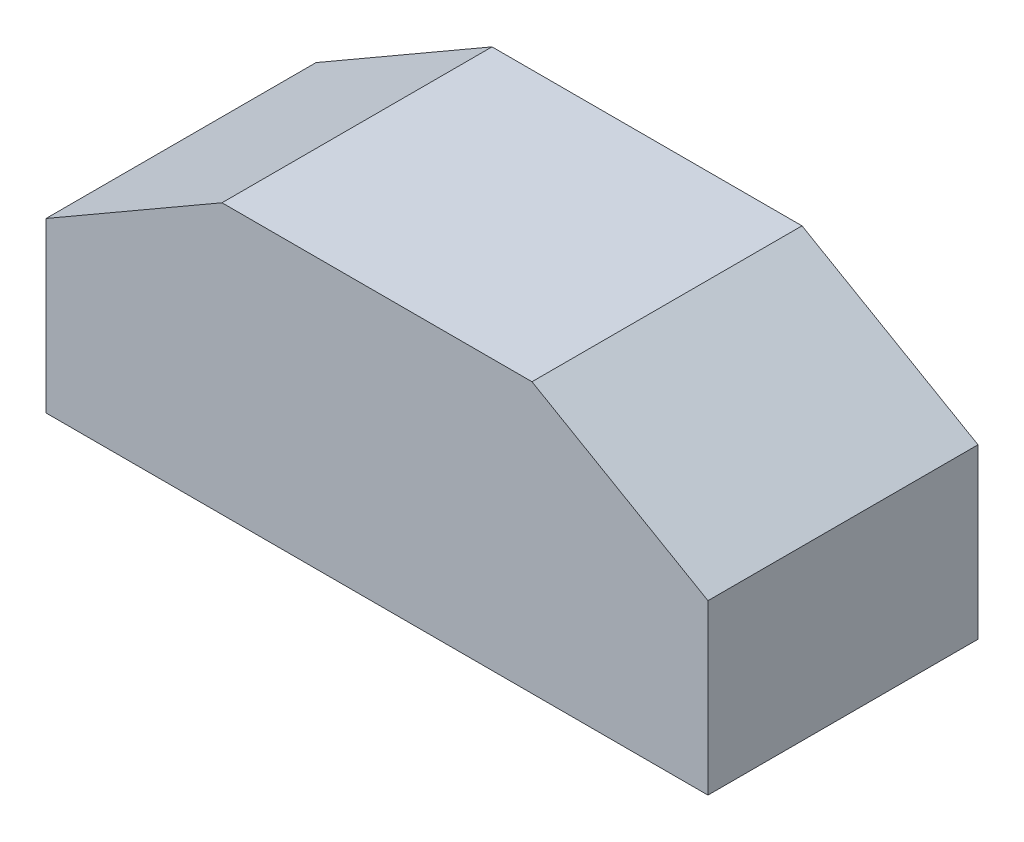
from build123d import *

# Parameters (mm, degrees)
BOSS_EXTRUDE1_DEPTH  = 10
BOSS_EXTRUDE2_DEPTH  = 2
BOSS_EXTRUDE3_DEPTH  = 2
SKETCH4_W            = 32.320508076
SKETCH4_H            = 7
BOSS_EXTRUDE4_DEPTH  = 2
SKETCH5_W            = 32.320508076
SKETCH5_H            = 7
BOSS_EXTRUDE5_DEPTH  = 2
BOSS_EXTRUDE9_DEPTH  = 14
BOSS_EXTRUDE10_DEPTH = 14


with BuildPart() as part:
    # Sketch1 → Boss-Extrude1 (new body)
    with BuildSketch(Plane.XY):
        Polygon((15, 0), (23.660254038, -5), (24.660254038, -3.267949192), (15.535898385, 2), (-0.535898385, 2), (-9.660254038, -3.267949192), (-8.660254038, -5), (0, 0), align=None)
    extrude(amount=BOSS_EXTRUDE1_DEPTH)

    # Sketch2 → Boss-Extrude2 (add)
    with BuildSketch(Plane.XY.offset(10)):
        Polygon((-8.660254038, -5), (23.660254038, -5), (15, 0), (0, 0), align=None)
        Polygon((23.660254038, -5), (24.660254038, -3.267949192), (15.535898385, 2), (-0.535898385, 2), (-9.660254038, -3.267949192), (-8.660254038, -5), (0, 0), (15, 0), align=None)
    extrude(amount=BOSS_EXTRUDE2_DEPTH)

    # Sketch3 → Boss-Extrude3 (add)
    with BuildSketch(Plane(origin=(0, 0, 0), x_dir=(-1, 0, 0), z_dir=(0, 0, -1))):
        Polygon((-24.660254038, -3.267949192), (-15.535898385, 2), (0.535898385, 2), (9.660254038, -3.267949192), (8.660254038, -5), (-23.660254038, -5), align=None)
    extrude(amount=BOSS_EXTRUDE3_DEPTH)

    # Sketch4 → Boss-Extrude4 (add)
    with BuildSketch(Plane.XY.offset(12)):
        with Locations((7.5, -8.5)):
            Rectangle(SKETCH4_W, SKETCH4_H)
    extrude(amount=-BOSS_EXTRUDE4_DEPTH)

    # Sketch5 → Boss-Extrude5 (add)
    with BuildSketch(Plane(origin=(0, 0, -2), x_dir=(-1, 0, 0), z_dir=(0, 0, -1))):
        with Locations((-7.5, -8.5)):
            Rectangle(SKETCH5_W, SKETCH5_H)
    extrude(amount=-BOSS_EXTRUDE5_DEPTH)

    # Sketch8 → Boss-Extrude9 (add)
    with BuildSketch(Plane.XY.offset(12)):
        Polygon((-9.660254038, -3.267949192), (-9.660254038, -12), (-8.660254038, -12), (-8.660254038, -5), align=None)
    extrude(amount=-BOSS_EXTRUDE9_DEPTH)

    # Sketch9 → Boss-Extrude10 (add)
    with BuildSketch(Plane(origin=(0, 0, -2), x_dir=(-1, 0, 0), z_dir=(0, 0, -1))):
        Polygon((-24.660254038, -3.267949192), (-23.660254038, -5), (-23.660254038, -12), (-24.660254038, -12), align=None)
    extrude(amount=-BOSS_EXTRUDE10_DEPTH)


solid = part.part
